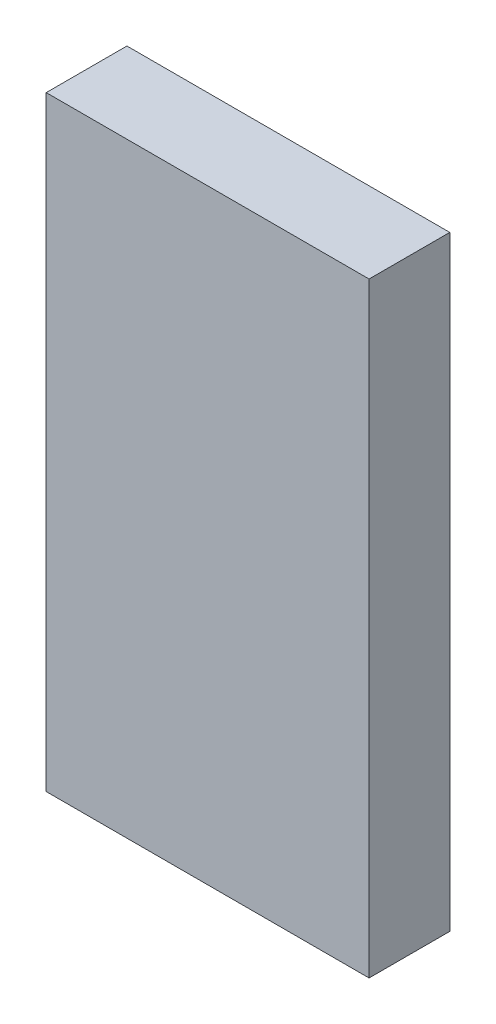
from build123d import *

# Parameters (mm, degrees)
SKETCH1_W           = 8
SKETCH1_H           = 15
BOSS_EXTRUDE1_DEPTH = 1
SKETCH2_R           = 1
CUT_EXTRUDE1_DEPTH  = 1


with BuildPart() as part:
    # Sketch1 → Boss-Extrude1 (new, symmetric)
    with BuildSketch(Plane.XY):
        Rectangle(SKETCH1_W, SKETCH1_H)
    extrude(amount=BOSS_EXTRUDE1_DEPTH, both=True)

    # Sketch2 → Cut-Extrude1 (cut)
    with BuildSketch(Plane(origin=(0, 0, -1), x_dir=(-1, 0, 0), z_dir=(0, 0, -1))):
        with Locations((0, 6)):
            Circle(SKETCH2_R)
        with Locations(Location((0, -6, 0), (0, 0, 180))):
            Circle(SKETCH2_R)
    extrude(amount=-CUT_EXTRUDE1_DEPTH, mode=Mode.SUBTRACT)


solid = part.part
